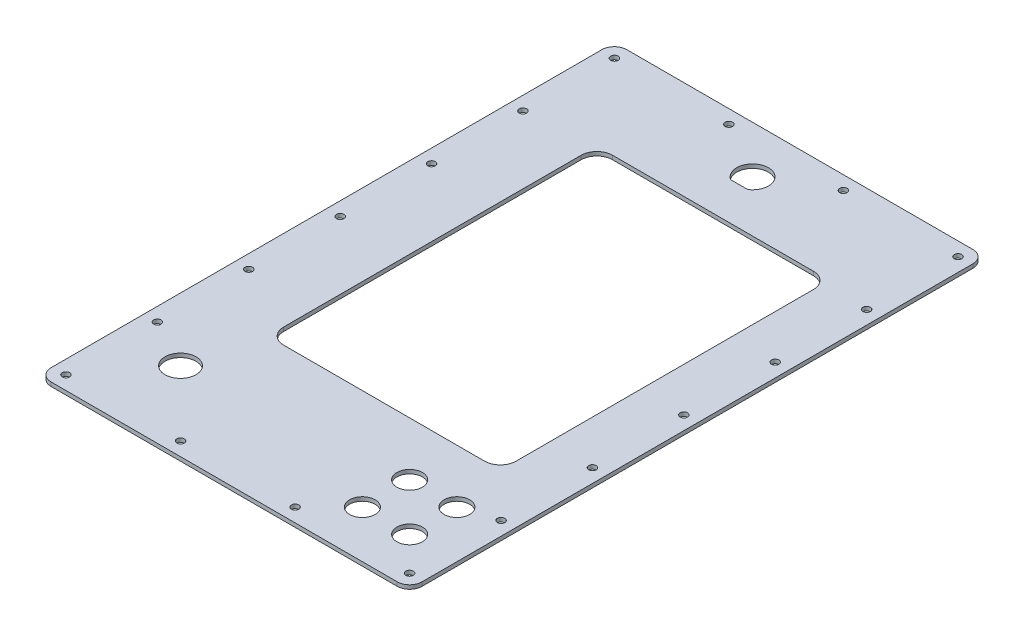
from build123d import *

# Parameters (mm, degrees)
SKETCH9_W           = 299
SKETCH9_H           = 464
SKETCH9_R           = 12.5
SKETCH9_R_2         = 10.287
SKETCH9_W_2         = 187.325
SKETCH9_H_2         = 265.1125
BOSS_EXTRUDE7_DEPTH = 3.175
FILLET4_R           = 10
FILLET5_R           = 12.7
SKETCH10_R          = 3
CUT_EXTRUDE1_DEPTH  = 3.175


with BuildPart() as part:
    # Sketch9 → Boss-Extrude7 (new body)
    with BuildSketch(Plane(origin=(0, 0, 0), x_dir=(1, 0, 0), z_dir=(0, 1, 0))):
        with Locations((0, 232)):
            Rectangle(SKETCH9_W, SKETCH9_H)
        with Locations(Location((-98.7, 63.5, 0), (0, 0, 270))):
            Circle(SKETCH9_R, mode=Mode.SUBTRACT)
        with Locations(Location((111.4, 76.2, 0), (0, 0, 270))):
            Circle(SKETCH9_R_2, mode=Mode.SUBTRACT)
        with Locations(Location((111.4, 38.1, 0), (0, 0, 270))):
            Circle(SKETCH9_R_2, mode=Mode.SUBTRACT)
        with Locations(Location((73.3, 76.2, 0), (0, 0, 270))):
            Circle(SKETCH9_R_2, mode=Mode.SUBTRACT)
        with Locations(Location((73.3, 38.1, 0), (0, 0, 270))):
            Circle(SKETCH9_R_2, mode=Mode.SUBTRACT)
        with Locations((9.5, 252)):
            Rectangle(SKETCH9_W_2, SKETCH9_H_2, mode=Mode.SUBTRACT)
        with BuildLine():
            Line((6.870225615, 415.1), (-6.870225615, 415.1))
            ThreePointArc((-6.870225615, 415.1), (0, 438.7), (6.870225615, 415.1))
        make_face(mode=Mode.SUBTRACT)
    extrude(amount=BOSS_EXTRUDE7_DEPTH)

    # Fillet4
    fillet4_edges = [part.edges().sort_by_distance(p)[0] for p in [
        (-149.5, 1.5875, -464),
        (149.5, 1.5875, -464),
        (149.5, 1.5875, 0),
        (-149.5, 1.5875, 0),
    ]]
    fillet(fillet4_edges, radius=FILLET4_R)

    # Fillet5
    fillet5_edges = [part.edges().sort_by_distance(p)[0] for p in [
        (103.1625, 1.5875, -119.44375),
        (103.1625, 1.5875, -384.55625),
        (-84.1625, 1.5875, -384.55625),
        (-84.1625, 1.5875, -119.44375),
    ]]
    fillet(fillet5_edges, radius=FILLET5_R)

    # Sketch10 → Cut-Extrude1 (cut)
    with BuildSketch(Plane(origin=(0, 3.175, 0), x_dir=(1, 0, 0), z_dir=(0, 1, 0))):
        with Locations(Location((-138.5, 11, 0), (0, 0, 270))):
            Circle(SKETCH10_R)
        with Locations(Location((-46.166666667, 11, 0), (0, 0, 270))):
            Circle(SKETCH10_R)
        with Locations(Location((46.166666667, 11, 0), (0, 0, 270))):
            Circle(SKETCH10_R)
        with Locations(Location((138.5, 11, 0), (0, 0, 270))):
            Circle(SKETCH10_R)
        with Locations(Location((-138.5, 84.666666667, 0), (0, 0, 270))):
            Circle(SKETCH10_R)
        with Locations(Location((-138.5, 158.333333333, 0), (0, 0, 270))):
            Circle(SKETCH10_R)
        with Locations(Location((-138.5, 232, 0), (0, 0, 270))):
            Circle(SKETCH10_R)
        with Locations(Location((-138.5, 305.666666667, 0), (0, 0, 270))):
            Circle(SKETCH10_R)
        with Locations(Location((-138.5, 379.333333333, 0), (0, 0, 270))):
            Circle(SKETCH10_R)
        with Locations(Location((-138.5, 453, 0), (0, 0, 270))):
            Circle(SKETCH10_R)
        with Locations(Location((138.5, 84.666666667, 0), (0, 0, 270))):
            Circle(SKETCH10_R)
        with Locations(Location((138.5, 158.333333333, 0), (0, 0, 270))):
            Circle(SKETCH10_R)
        with Locations(Location((138.5, 232, 0), (0, 0, 270))):
            Circle(SKETCH10_R)
        with Locations(Location((138.5, 305.666666667, 0), (0, 0, 270))):
            Circle(SKETCH10_R)
        with Locations(Location((138.5, 379.333333333, 0), (0, 0, 270))):
            Circle(SKETCH10_R)
        with Locations(Location((-46.166666667, 453, 0), (0, 0, 270))):
            Circle(SKETCH10_R)
        with Locations(Location((46.166666667, 453, 0), (0, 0, 270))):
            Circle(SKETCH10_R)
        with Locations(Location((138.5, 453, 0), (0, 0, 270))):
            Circle(SKETCH10_R)
    extrude(amount=-CUT_EXTRUDE1_DEPTH, mode=Mode.SUBTRACT)


solid = part.part
